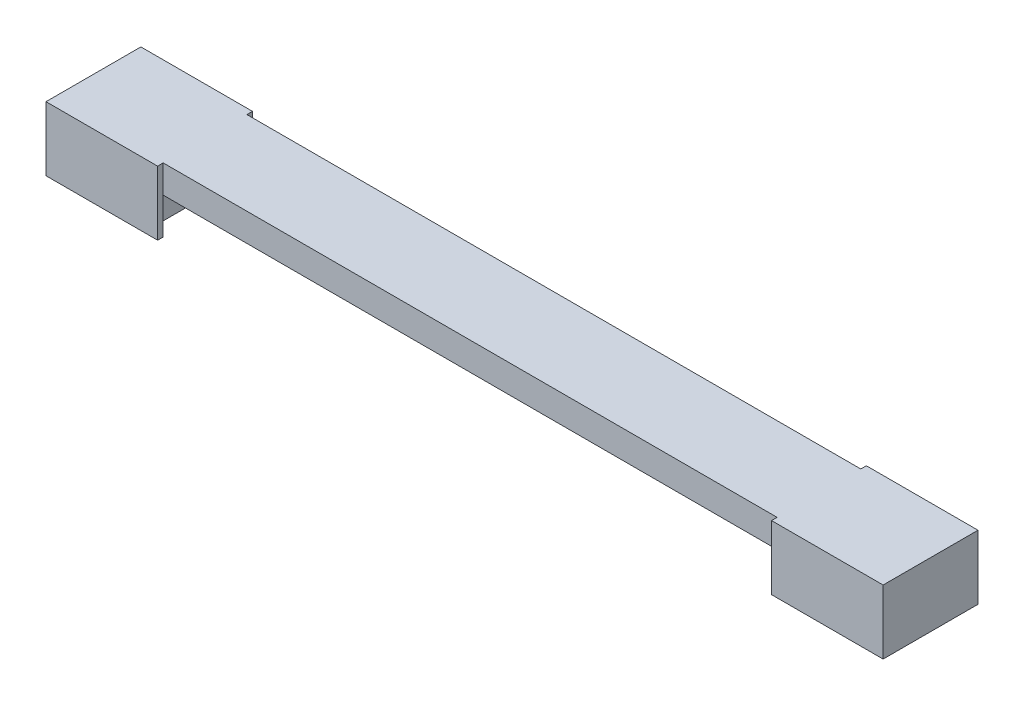
from build123d import *

# Parameters (mm, degrees)
AUFSATZ_LINEAR_AUSTRAGEN1_DEPTH             = 15
AUFSATZ_LINEAR_AUSTRAGEN4_DEPTH             = 1.5
AUFSATZ_LINEAR_AUSTRAGEN4_DIRECTION_2_REACH = 78.164


with BuildPart() as part:
    # Skizze1 → Aufsatz-Linear austragen1 (new body)
    with BuildSketch(Plane.XY):
        Polygon((-74, 0), (-74, -10), (-56, -10), (-56, -5), (56, -5), (56, -10), (74, -10), (74, 0), align=None)
    extrude(amount=AUFSATZ_LINEAR_AUSTRAGEN1_DEPTH)

    # Skizze5 → Aufsatz-Linear austragen4 (add)
    with BuildSketch(Plane.XZ.offset(10)):
        Polygon((56, 0), (55, 0), (55, -1), (56, -1), (75, -1), (75, 16), (56, 16), (55, 16), (55, 15), (56, 15), (74, 15), (74, 0), align=None)
    aufsatz_linear_austragen4 = extrude(amount=AUFSATZ_LINEAR_AUSTRAGEN4_DEPTH)

    # Aufsatz-Linear austragen4 direction 2: up to this face of the body (flat: up to its plane)
    aufsatz_linear_austragen4_direction_2_end = Plane(part.part.faces().sort_by_distance((0, 0, 7.5))[0])
    # Skizze5 → Aufsatz-Linear austragen4 direction 2 (add, up to the picked face)
    with BuildSketch(Plane.XZ.offset(10), mode=Mode.PRIVATE) as aufsatz_linear_austragen4_direction_2_sk1:
        Polygon((56, 0), (55, 0), (55, -1), (56, -1), (75, -1), (75, 16), (56, 16), (55, 16), (55, 15), (56, 15), (74, 15), (74, 0), align=None)
    aufsatz_linear_austragen4_direction_2_tool1 = split(extrude(aufsatz_linear_austragen4_direction_2_sk1.sketch, amount=-AUFSATZ_LINEAR_AUSTRAGEN4_DIRECTION_2_REACH, mode=Mode.PRIVATE), bisect_by=aufsatz_linear_austragen4_direction_2_end, keep=Keep.BOTH, mode=Mode.PRIVATE)
    aufsatz_linear_austragen4_direction_2 = aufsatz_linear_austragen4_direction_2_tool1.solids().sort_by(Axis((55.5, -10, -0.262488), (0, 1, 0)))[0]
    add(aufsatz_linear_austragen4_direction_2)

    # Spiegeln1: Aufsatz-Linear austragen4, Aufsatz-Linear austragen4 direction 2 across plane
    add(aufsatz_linear_austragen4.mirror(Plane(origin=(0, 0, 0), x_dir=(0, 0, 1), z_dir=(1, 0, 0))))
    add(aufsatz_linear_austragen4_direction_2.mirror(Plane(origin=(0, 0, 0), x_dir=(0, 0, 1), z_dir=(1, 0, 0))))


solid = part.part
